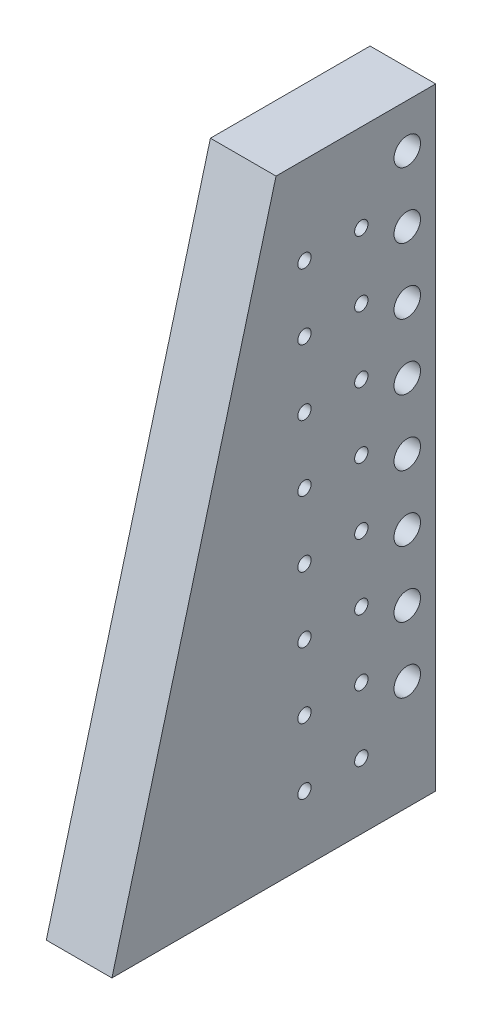
from build123d import *

# Parameters (mm, degrees)
SKETCH2_R           = 3.025
SKETCH2_R_2         = 1.525
BOSS_EXTRUDE2_DEPTH = 15


with BuildPart() as part:
    # Sketch2 → Boss-Extrude2 (new body)
    with BuildSketch(Plane(origin=(0, 0, 0), x_dir=(0, 0, -1), z_dir=(1, 0, 0))):
        Polygon((-56.025707453, -71.794871795), (17.987179487, -71.794871795), (17.987179487, 68.205128205), (-18.512820513, 68.205128205), align=None)
        with Locations((11.487179487, 58.205128205)):
            Circle(SKETCH2_R, mode=Mode.SUBTRACT)
        with Locations((11.487179487, 43.205128205)):
            Circle(SKETCH2_R, mode=Mode.SUBTRACT)
        with Locations((11.487179487, 28.205128205)):
            Circle(SKETCH2_R, mode=Mode.SUBTRACT)
        with Locations((11.487179487, 13.205128205)):
            Circle(SKETCH2_R, mode=Mode.SUBTRACT)
        with Locations((11.487179487, -1.794871795)):
            Circle(SKETCH2_R, mode=Mode.SUBTRACT)
        with Locations((11.487179487, -16.794871795)):
            Circle(SKETCH2_R, mode=Mode.SUBTRACT)
        with Locations((11.487179487, -31.794871795)):
            Circle(SKETCH2_R, mode=Mode.SUBTRACT)
        with Locations((11.487179487, -46.794871795)):
            Circle(SKETCH2_R, mode=Mode.SUBTRACT)
        with Locations((0.987179487, 48.205128205)):
            Circle(SKETCH2_R_2, mode=Mode.SUBTRACT)
        with Locations((-12.012820513, 48.205128205)):
            Circle(SKETCH2_R_2, mode=Mode.SUBTRACT)
        with Locations((0.987179487, 33.205128205)):
            Circle(SKETCH2_R_2, mode=Mode.SUBTRACT)
        with Locations((-12.012820513, 33.205128205)):
            Circle(SKETCH2_R_2, mode=Mode.SUBTRACT)
        with Locations((0.987179487, 18.205128205)):
            Circle(SKETCH2_R_2, mode=Mode.SUBTRACT)
        with Locations((-12.012820513, 18.205128205)):
            Circle(SKETCH2_R_2, mode=Mode.SUBTRACT)
        with Locations((0.987179487, 3.205128205)):
            Circle(SKETCH2_R_2, mode=Mode.SUBTRACT)
        with Locations((-12.012820513, 3.205128205)):
            Circle(SKETCH2_R_2, mode=Mode.SUBTRACT)
        with Locations((0.987179487, -11.794871795)):
            Circle(SKETCH2_R_2, mode=Mode.SUBTRACT)
        with Locations((-12.012820513, -11.794871795)):
            Circle(SKETCH2_R_2, mode=Mode.SUBTRACT)
        with Locations((0.987179487, -26.794871795)):
            Circle(SKETCH2_R_2, mode=Mode.SUBTRACT)
        with Locations((-12.012820513, -26.794871795)):
            Circle(SKETCH2_R_2, mode=Mode.SUBTRACT)
        with Locations((0.987179487, -41.794871795)):
            Circle(SKETCH2_R_2, mode=Mode.SUBTRACT)
        with Locations((-12.012820513, -41.794871795)):
            Circle(SKETCH2_R_2, mode=Mode.SUBTRACT)
        with Locations((0.987179487, -56.794871795)):
            Circle(SKETCH2_R_2, mode=Mode.SUBTRACT)
        with Locations((-12.012820513, -56.794871795)):
            Circle(SKETCH2_R_2, mode=Mode.SUBTRACT)
    extrude(amount=BOSS_EXTRUDE2_DEPTH)


solid = part.part
